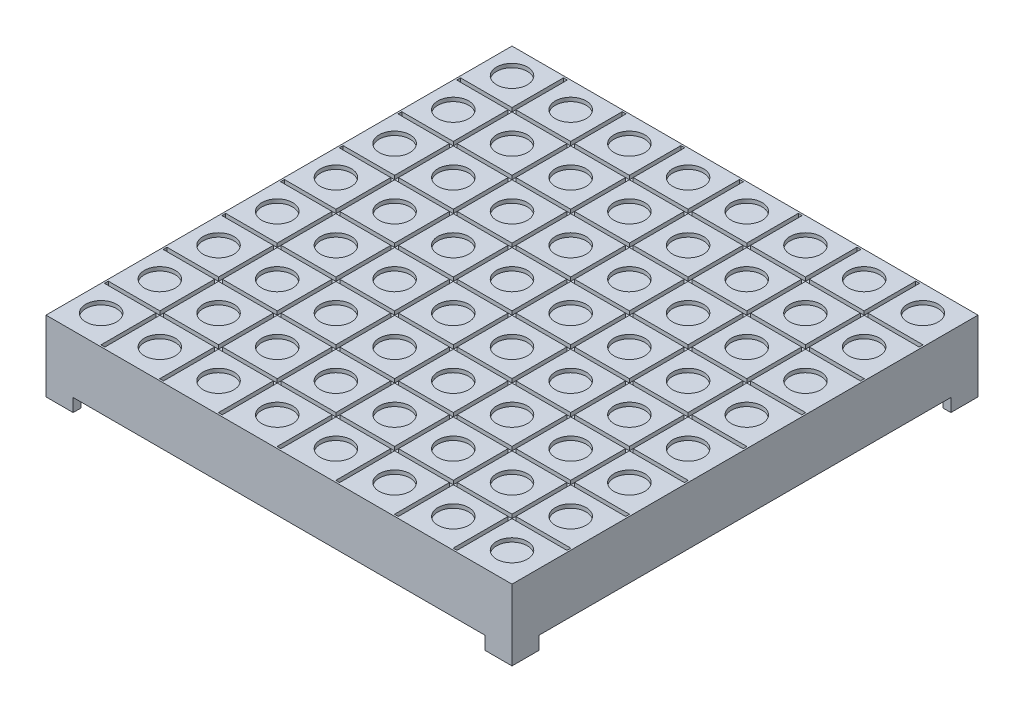
from build123d import *

# Parameters (mm, degrees)
SKETCH_2_W          = 60.5
SKETCH_2_H          = 60.5
EXTRUDE_1_DEPTH     = 7.5
SKETCH_4_W          = 58.5
SKETCH_4_H          = 58.5
CUT_EXTRUDE_2_DEPTH = 1
EXTRUDE_2_DEPTH     = 1.7
SKETCH_3_R          = 2
SKETCH_3_W          = 7.12
SKETCH_3_H          = 7.12
CUT_EXTRUDE_4_DEPTH = 0.5
SKETCH_8_R          = 0.5
EXTRUDE_3_DEPTH     = 3


with BuildPart() as part:
    # Эскиз2 → Бобышка-Вытянуть1 (new body)
    with BuildSketch(Plane(origin=(0, 0, 0), x_dir=(1, 0, 0), z_dir=(0, 1, 0))):
        Rectangle(SKETCH_2_W, SKETCH_2_H)
    extrude(amount=EXTRUDE_1_DEPTH)

    # Эскиз4 → Вырез-Вытянуть2 (cut)
    with BuildSketch(Plane.XZ):
        Rectangle(SKETCH_4_W, SKETCH_4_H)
    extrude(amount=-CUT_EXTRUDE_2_DEPTH, mode=Mode.SUBTRACT)

    # Эскиз5 → Бобышка-Вытянуть2 (add)
    with BuildSketch(Plane.XZ):
        Polygon((26.725, 30.25), (30.25, 30.25), (30.25, 26.725), (29.25, 26.725), (29.25, 29.25), (26.725, 29.25), align=None)
        Polygon((-26.725, -30.25), (-30.25, -30.25), (-30.25, -26.725), (-29.25, -26.725), (-29.25, -29.25), (-26.725, -29.25), align=None)
        Polygon((-30.25, 30.25), (-30.25, 26.725), (-29.25, 26.725), (-29.25, 29.25), (-26.725, 29.25), (-26.725, 30.25), align=None)
        Polygon((30.25, -30.25), (30.25, -26.725), (29.25, -26.725), (29.25, -29.25), (26.725, -29.25), (26.725, -30.25), align=None)
    extrude(amount=EXTRUDE_2_DEPTH)

    # Эскиз3 → Вырез-Вытянуть4 (cut)
    # profile 1 of 65: a face of its own
    with BuildSketch(Plane(origin=(0, 7.5, 0), x_dir=(1, 0, 0), z_dir=(0, 1, 0))):
        with Locations(Location((26.445, -26.445, 0), (0, 0, 270))):
            Circle(SKETCH_3_R)
    # profile 2 of 65: a face of its own
    with BuildSketch(Plane(origin=(0, 7.5, 0), x_dir=(1, 0, 0), z_dir=(0, 1, 0))):
        with Locations(Location((18.825, -26.445, 0), (0, 0, 270))):
            Circle(SKETCH_3_R)
    # profile 3 of 65: a face of its own
    with BuildSketch(Plane(origin=(0, 7.5, 0), x_dir=(1, 0, 0), z_dir=(0, 1, 0))):
        with Locations(Location((11.205, -26.445, 0), (0, 0, 270))):
            Circle(SKETCH_3_R)
    # profile 4 of 65: a face of its own
    with BuildSketch(Plane(origin=(0, 7.5, 0), x_dir=(1, 0, 0), z_dir=(0, 1, 0))):
        with Locations(Location((3.585, -26.445, 0), (0, 0, 270))):
            Circle(SKETCH_3_R)
    # profile 5 of 65: a face of its own
    with BuildSketch(Plane(origin=(0, 7.5, 0), x_dir=(1, 0, 0), z_dir=(0, 1, 0))):
        with Locations(Location((-4.035, -26.445, 0), (0, 0, 270))):
            Circle(SKETCH_3_R)
    # profile 6 of 65: a face of its own
    with BuildSketch(Plane(origin=(0, 7.5, 0), x_dir=(1, 0, 0), z_dir=(0, 1, 0))):
        with Locations(Location((-11.655, -26.445, 0), (0, 0, 270))):
            Circle(SKETCH_3_R)
    # profile 7 of 65: a face of its own
    with BuildSketch(Plane(origin=(0, 7.5, 0), x_dir=(1, 0, 0), z_dir=(0, 1, 0))):
        with Locations(Location((-19.275, -26.445, 0), (0, 0, 270))):
            Circle(SKETCH_3_R)
    # profile 8 of 65: a face of its own
    with BuildSketch(Plane(origin=(0, 7.5, 0), x_dir=(1, 0, 0), z_dir=(0, 1, 0))):
        with Locations(Location((-26.895, -26.445, 0), (0, 0, 270))):
            Circle(SKETCH_3_R)
    # profile 9 of 65: a face of its own
    with BuildSketch(Plane(origin=(0, 7.5, 0), x_dir=(1, 0, 0), z_dir=(0, 1, 0))):
        with Locations(Location((-26.895, -18.825, 0), (0, 0, 270))):
            Circle(SKETCH_3_R)
    # profile 10 of 65: a face of its own
    with BuildSketch(Plane(origin=(0, 7.5, 0), x_dir=(1, 0, 0), z_dir=(0, 1, 0))):
        with Locations(Location((-26.895, -11.205, 0), (0, 0, 270))):
            Circle(SKETCH_3_R)
    # profile 11 of 65: a face of its own
    with BuildSketch(Plane(origin=(0, 7.5, 0), x_dir=(1, 0, 0), z_dir=(0, 1, 0))):
        with Locations(Location((-26.895, -3.585, 0), (0, 0, 270))):
            Circle(SKETCH_3_R)
    # profile 12 of 65: a face of its own
    with BuildSketch(Plane(origin=(0, 7.5, 0), x_dir=(1, 0, 0), z_dir=(0, 1, 0))):
        with Locations(Location((-26.895, 4.035, 0), (0, 0, 270))):
            Circle(SKETCH_3_R)
    # profile 13 of 65: a face of its own
    with BuildSketch(Plane(origin=(0, 7.5, 0), x_dir=(1, 0, 0), z_dir=(0, 1, 0))):
        with Locations(Location((-26.895, 11.655, 0), (0, 0, 270))):
            Circle(SKETCH_3_R)
    # profile 14 of 65: a face of its own
    with BuildSketch(Plane(origin=(0, 7.5, 0), x_dir=(1, 0, 0), z_dir=(0, 1, 0))):
        with Locations(Location((-26.895, 19.275, 0), (0, 0, 270))):
            Circle(SKETCH_3_R)
    # profile 15 of 65: a face of its own
    with BuildSketch(Plane(origin=(0, 7.5, 0), x_dir=(1, 0, 0), z_dir=(0, 1, 0))):
        with Locations(Location((18.825, 26.895, 0), (0, 0, 270))):
            Circle(SKETCH_3_R)
    # profile 16 of 65: a face of its own
    with BuildSketch(Plane(origin=(0, 7.5, 0), x_dir=(1, 0, 0), z_dir=(0, 1, 0))):
        with Locations(Location((11.205, 26.895, 0), (0, 0, 270))):
            Circle(SKETCH_3_R)
    # profile 17 of 65: a face of its own
    with BuildSketch(Plane(origin=(0, 7.5, 0), x_dir=(1, 0, 0), z_dir=(0, 1, 0))):
        with Locations(Location((3.585, 26.895, 0), (0, 0, 270))):
            Circle(SKETCH_3_R)
    # profile 18 of 65: a face of its own
    with BuildSketch(Plane(origin=(0, 7.5, 0), x_dir=(1, 0, 0), z_dir=(0, 1, 0))):
        with Locations(Location((-4.035, 26.895, 0), (0, 0, 270))):
            Circle(SKETCH_3_R)
    # profile 19 of 65: a face of its own
    with BuildSketch(Plane(origin=(0, 7.5, 0), x_dir=(1, 0, 0), z_dir=(0, 1, 0))):
        with Locations(Location((-11.655, 26.895, 0), (0, 0, 270))):
            Circle(SKETCH_3_R)
    # profile 20 of 65: a face of its own
    with BuildSketch(Plane(origin=(0, 7.5, 0), x_dir=(1, 0, 0), z_dir=(0, 1, 0))):
        with Locations(Location((-19.275, 26.895, 0), (0, 0, 270))):
            Circle(SKETCH_3_R)
    # profile 21 of 65: a face of its own
    with BuildSketch(Plane(origin=(0, 7.5, 0), x_dir=(1, 0, 0), z_dir=(0, 1, 0))):
        with Locations(Location((-26.895, 26.895, 0), (0, 0, 270))):
            Circle(SKETCH_3_R)
    # profile 22 of 65: a face of its own
    with BuildSketch(Plane(origin=(0, 7.5, 0), x_dir=(1, 0, 0), z_dir=(0, 1, 0))):
        with Locations(Location((26.445, -18.825, 0), (0, 0, 270))):
            Circle(SKETCH_3_R)
    # profile 23 of 65: a face of its own
    with BuildSketch(Plane(origin=(0, 7.5, 0), x_dir=(1, 0, 0), z_dir=(0, 1, 0))):
        with Locations(Location((26.445, -11.205, 0), (0, 0, 270))):
            Circle(SKETCH_3_R)
    # profile 24 of 65: a face of its own
    with BuildSketch(Plane(origin=(0, 7.5, 0), x_dir=(1, 0, 0), z_dir=(0, 1, 0))):
        with Locations(Location((26.445, -3.585, 0), (0, 0, 270))):
            Circle(SKETCH_3_R)
    # profile 25 of 65: a face of its own
    with BuildSketch(Plane(origin=(0, 7.5, 0), x_dir=(1, 0, 0), z_dir=(0, 1, 0))):
        with Locations(Location((26.445, 4.035, 0), (0, 0, 270))):
            Circle(SKETCH_3_R)
    # profile 26 of 65: a face of its own
    with BuildSketch(Plane(origin=(0, 7.5, 0), x_dir=(1, 0, 0), z_dir=(0, 1, 0))):
        with Locations(Location((26.445, 11.655, 0), (0, 0, 270))):
            Circle(SKETCH_3_R)
    # profile 27 of 65: a face of its own
    with BuildSketch(Plane(origin=(0, 7.5, 0), x_dir=(1, 0, 0), z_dir=(0, 1, 0))):
        with Locations(Location((26.445, 19.275, 0), (0, 0, 270))):
            Circle(SKETCH_3_R)
    # profile 28 of 65: a face of its own
    with BuildSketch(Plane(origin=(0, 7.5, 0), x_dir=(1, 0, 0), z_dir=(0, 1, 0))):
        with Locations(Location((26.445, 26.895, 0), (0, 0, 270))):
            Circle(SKETCH_3_R)
    # profile 29 of 65: a face of its own
    with BuildSketch(Plane(origin=(0, 7.5, 0), x_dir=(1, 0, 0), z_dir=(0, 1, 0))):
        Polygon((22.885, -30.025), (22.885, -22.885), (30.025, -22.885), (30.025, -22.385), (22.885, -22.385), (22.885, -15.265), (30.025, -15.265), (30.025, -14.765), (22.885, -14.765), (22.885, -7.645), (30.025, -7.645), (30.025, -7.145), (22.885, -7.145), (22.885, -0.025), (30.025, -0.025), (30.025, 0.475), (22.885, 0.475), (22.885, 7.595), (30.025, 7.595), (30.025, 8.095), (22.885, 8.095), (22.885, 15.215), (30.025, 15.215), (30.025, 15.715), (22.885, 15.715), (22.885, 22.835), (30.025, 22.835), (30.025, 23.335), (22.885, 23.335), (22.885, 30.025), (22.385, 30.025), (22.385, 23.335), (15.265, 23.335), (15.265, 30.025), (14.765, 30.025), (14.765, 23.335), (7.645, 23.335), (7.645, 30.025), (7.145, 30.025), (7.145, 23.335), (0.025, 23.335), (0.025, 30.025), (-0.475, 30.025), (-0.475, 23.335), (-7.595, 23.335), (-7.595, 30.025), (-8.095, 30.025), (-8.095, 23.335), (-15.215, 23.335), (-15.215, 30.025), (-15.715, 30.025), (-15.715, 23.335), (-22.835, 23.335), (-22.835, 30.025), (-23.335, 30.025), (-23.335, 23.335), (-30.025, 23.335), (-30.025, 22.835), (-23.335, 22.835), (-23.335, 15.715), (-30.025, 15.715), (-30.025, 15.215), (-23.335, 15.215), (-23.335, 8.095), (-30.025, 8.095), (-30.025, 7.595), (-23.335, 7.595), (-23.335, 0.475), (-30.025, 0.475), (-30.025, -0.025), (-23.335, -0.025), (-23.335, -7.145), (-30.025, -7.145), (-30.025, -7.645), (-23.335, -7.645), (-23.335, -14.765), (-30.025, -14.765), (-30.025, -15.265), (-23.335, -15.265), (-23.335, -22.385), (-30.025, -22.385), (-30.025, -22.885), (-23.335, -22.885), (-23.335, -30.025), (-22.835, -30.025), (-22.835, -22.885), (-15.715, -22.885), (-15.715, -30.025), (-15.215, -30.025), (-15.215, -22.885), (-8.095, -22.885), (-8.095, -30.025), (-7.595, -30.025), (-7.595, -22.885), (-0.475, -22.885), (-0.475, -30.025), (0.025, -30.025), (0.025, -22.885), (7.145, -22.885), (7.145, -30.025), (7.645, -30.025), (7.645, -22.885), (14.765, -22.885), (14.765, -30.025), (15.265, -30.025), (15.265, -22.885), (22.385, -22.885), (22.385, -30.025), align=None)
        with Locations((-19.275, -11.205)):
            Rectangle(SKETCH_3_W, SKETCH_3_H, mode=Mode.SUBTRACT)
        with Locations((-11.655, -11.205)):
            Rectangle(SKETCH_3_W, SKETCH_3_H, mode=Mode.SUBTRACT)
        with Locations((18.825, -18.825)):
            Rectangle(SKETCH_3_W, SKETCH_3_H, mode=Mode.SUBTRACT)
        with Locations((11.205, -18.825)):
            Rectangle(SKETCH_3_W, SKETCH_3_H, mode=Mode.SUBTRACT)
        with Locations((3.585, -18.825)):
            Rectangle(SKETCH_3_W, SKETCH_3_H, mode=Mode.SUBTRACT)
        with Locations((-4.035, -18.825)):
            Rectangle(SKETCH_3_W, SKETCH_3_H, mode=Mode.SUBTRACT)
        with Locations((-11.655, -18.825)):
            Rectangle(SKETCH_3_W, SKETCH_3_H, mode=Mode.SUBTRACT)
        with Locations((-19.275, -18.825)):
            Rectangle(SKETCH_3_W, SKETCH_3_H, mode=Mode.SUBTRACT)
        with Locations((-4.035, -11.205)):
            Rectangle(SKETCH_3_W, SKETCH_3_H, mode=Mode.SUBTRACT)
        with Locations((3.585, -11.205)):
            Rectangle(SKETCH_3_W, SKETCH_3_H, mode=Mode.SUBTRACT)
        with Locations((11.205, -11.205)):
            Rectangle(SKETCH_3_W, SKETCH_3_H, mode=Mode.SUBTRACT)
        with Locations((18.825, -11.205)):
            Rectangle(SKETCH_3_W, SKETCH_3_H, mode=Mode.SUBTRACT)
        with Locations((18.825, -3.585)):
            Rectangle(SKETCH_3_W, SKETCH_3_H, mode=Mode.SUBTRACT)
        with Locations((11.205, -3.585)):
            Rectangle(SKETCH_3_W, SKETCH_3_H, mode=Mode.SUBTRACT)
        with Locations((3.585, -3.585)):
            Rectangle(SKETCH_3_W, SKETCH_3_H, mode=Mode.SUBTRACT)
        with Locations((-4.035, -3.585)):
            Rectangle(SKETCH_3_W, SKETCH_3_H, mode=Mode.SUBTRACT)
        with Locations((-11.655, -3.585)):
            Rectangle(SKETCH_3_W, SKETCH_3_H, mode=Mode.SUBTRACT)
        with Locations((-19.275, -3.585)):
            Rectangle(SKETCH_3_W, SKETCH_3_H, mode=Mode.SUBTRACT)
        with Locations((-19.275, 4.035)):
            Rectangle(SKETCH_3_W, SKETCH_3_H, mode=Mode.SUBTRACT)
        with Locations((-11.655, 4.035)):
            Rectangle(SKETCH_3_W, SKETCH_3_H, mode=Mode.SUBTRACT)
        with Locations((-4.035, 4.035)):
            Rectangle(SKETCH_3_W, SKETCH_3_H, mode=Mode.SUBTRACT)
        with Locations((3.585, 4.035)):
            Rectangle(SKETCH_3_W, SKETCH_3_H, mode=Mode.SUBTRACT)
        with Locations((11.205, 4.035)):
            Rectangle(SKETCH_3_W, SKETCH_3_H, mode=Mode.SUBTRACT)
        with Locations((18.825, 4.035)):
            Rectangle(SKETCH_3_W, SKETCH_3_H, mode=Mode.SUBTRACT)
        with Locations((18.825, 11.655)):
            Rectangle(SKETCH_3_W, SKETCH_3_H, mode=Mode.SUBTRACT)
        with Locations((11.205, 11.655)):
            Rectangle(SKETCH_3_W, SKETCH_3_H, mode=Mode.SUBTRACT)
        with Locations((3.585, 11.655)):
            Rectangle(SKETCH_3_W, SKETCH_3_H, mode=Mode.SUBTRACT)
        with Locations((-4.035, 11.655)):
            Rectangle(SKETCH_3_W, SKETCH_3_H, mode=Mode.SUBTRACT)
        with Locations((-11.655, 11.655)):
            Rectangle(SKETCH_3_W, SKETCH_3_H, mode=Mode.SUBTRACT)
        with Locations((-19.275, 11.655)):
            Rectangle(SKETCH_3_W, SKETCH_3_H, mode=Mode.SUBTRACT)
        with Locations((18.825, 19.275)):
            Rectangle(SKETCH_3_W, SKETCH_3_H, mode=Mode.SUBTRACT)
        with Locations((11.205, 19.275)):
            Rectangle(SKETCH_3_W, SKETCH_3_H, mode=Mode.SUBTRACT)
        with Locations((3.585, 19.275)):
            Rectangle(SKETCH_3_W, SKETCH_3_H, mode=Mode.SUBTRACT)
        with Locations((-4.035, 19.275)):
            Rectangle(SKETCH_3_W, SKETCH_3_H, mode=Mode.SUBTRACT)
        with Locations((-11.655, 19.275)):
            Rectangle(SKETCH_3_W, SKETCH_3_H, mode=Mode.SUBTRACT)
        with Locations((-19.275, 19.275)):
            Rectangle(SKETCH_3_W, SKETCH_3_H, mode=Mode.SUBTRACT)
    # profile 30 of 65: a face of its own
    with BuildSketch(Plane(origin=(0, 7.5, 0), x_dir=(1, 0, 0), z_dir=(0, 1, 0))):
        with Locations(Location((-19.275, 19.275, 0), (0, 0, 270))):
            Circle(SKETCH_3_R)
    # profile 31 of 65: a face of its own
    with BuildSketch(Plane(origin=(0, 7.5, 0), x_dir=(1, 0, 0), z_dir=(0, 1, 0))):
        with Locations(Location((-11.655, 19.275, 0), (0, 0, 270))):
            Circle(SKETCH_3_R)
    # profile 32 of 65: a face of its own
    with BuildSketch(Plane(origin=(0, 7.5, 0), x_dir=(1, 0, 0), z_dir=(0, 1, 0))):
        with Locations(Location((-4.035, 19.275, 0), (0, 0, 270))):
            Circle(SKETCH_3_R)
    # profile 33 of 65: a face of its own
    with BuildSketch(Plane(origin=(0, 7.5, 0), x_dir=(1, 0, 0), z_dir=(0, 1, 0))):
        with Locations(Location((3.585, 19.275, 0), (0, 0, 270))):
            Circle(SKETCH_3_R)
    # profile 34 of 65: a face of its own
    with BuildSketch(Plane(origin=(0, 7.5, 0), x_dir=(1, 0, 0), z_dir=(0, 1, 0))):
        with Locations(Location((11.205, 19.275, 0), (0, 0, 270))):
            Circle(SKETCH_3_R)
    # profile 35 of 65: a face of its own
    with BuildSketch(Plane(origin=(0, 7.5, 0), x_dir=(1, 0, 0), z_dir=(0, 1, 0))):
        with Locations(Location((18.825, 19.275, 0), (0, 0, 270))):
            Circle(SKETCH_3_R)
    # profile 36 of 65: a face of its own
    with BuildSketch(Plane(origin=(0, 7.5, 0), x_dir=(1, 0, 0), z_dir=(0, 1, 0))):
        with Locations(Location((-19.275, 11.655, 0), (0, 0, 270))):
            Circle(SKETCH_3_R)
    # profile 37 of 65: a face of its own
    with BuildSketch(Plane(origin=(0, 7.5, 0), x_dir=(1, 0, 0), z_dir=(0, 1, 0))):
        with Locations(Location((-11.655, 11.655, 0), (0, 0, 270))):
            Circle(SKETCH_3_R)
    # profile 38 of 65: a face of its own
    with BuildSketch(Plane(origin=(0, 7.5, 0), x_dir=(1, 0, 0), z_dir=(0, 1, 0))):
        with Locations(Location((-4.035, 11.655, 0), (0, 0, 270))):
            Circle(SKETCH_3_R)
    # profile 39 of 65: a face of its own
    with BuildSketch(Plane(origin=(0, 7.5, 0), x_dir=(1, 0, 0), z_dir=(0, 1, 0))):
        with Locations(Location((3.585, 11.655, 0), (0, 0, 270))):
            Circle(SKETCH_3_R)
    # profile 40 of 65: a face of its own
    with BuildSketch(Plane(origin=(0, 7.5, 0), x_dir=(1, 0, 0), z_dir=(0, 1, 0))):
        with Locations(Location((11.205, 11.655, 0), (0, 0, 270))):
            Circle(SKETCH_3_R)
    # profile 41 of 65: a face of its own
    with BuildSketch(Plane(origin=(0, 7.5, 0), x_dir=(1, 0, 0), z_dir=(0, 1, 0))):
        with Locations(Location((18.825, 11.655, 0), (0, 0, 270))):
            Circle(SKETCH_3_R)
    # profile 42 of 65: a face of its own
    with BuildSketch(Plane(origin=(0, 7.5, 0), x_dir=(1, 0, 0), z_dir=(0, 1, 0))):
        with Locations(Location((-19.275, 4.035, 0), (0, 0, 270))):
            Circle(SKETCH_3_R)
    # profile 43 of 65: a face of its own
    with BuildSketch(Plane(origin=(0, 7.5, 0), x_dir=(1, 0, 0), z_dir=(0, 1, 0))):
        with Locations(Location((-11.655, 4.035, 0), (0, 0, 270))):
            Circle(SKETCH_3_R)
    # profile 44 of 65: a face of its own
    with BuildSketch(Plane(origin=(0, 7.5, 0), x_dir=(1, 0, 0), z_dir=(0, 1, 0))):
        with Locations(Location((-4.035, 4.035, 0), (0, 0, 270))):
            Circle(SKETCH_3_R)
    # profile 45 of 65: a face of its own
    with BuildSketch(Plane(origin=(0, 7.5, 0), x_dir=(1, 0, 0), z_dir=(0, 1, 0))):
        with Locations(Location((3.585, 4.035, 0), (0, 0, 270))):
            Circle(SKETCH_3_R)
    # profile 46 of 65: a face of its own
    with BuildSketch(Plane(origin=(0, 7.5, 0), x_dir=(1, 0, 0), z_dir=(0, 1, 0))):
        with Locations(Location((11.205, 4.035, 0), (0, 0, 270))):
            Circle(SKETCH_3_R)
    # profile 47 of 65: a face of its own
    with BuildSketch(Plane(origin=(0, 7.5, 0), x_dir=(1, 0, 0), z_dir=(0, 1, 0))):
        with Locations(Location((18.825, 4.035, 0), (0, 0, 270))):
            Circle(SKETCH_3_R)
    # profile 48 of 65: a face of its own
    with BuildSketch(Plane(origin=(0, 7.5, 0), x_dir=(1, 0, 0), z_dir=(0, 1, 0))):
        with Locations(Location((-19.275, -3.585, 0), (0, 0, 270))):
            Circle(SKETCH_3_R)
    # profile 49 of 65: a face of its own
    with BuildSketch(Plane(origin=(0, 7.5, 0), x_dir=(1, 0, 0), z_dir=(0, 1, 0))):
        with Locations(Location((-11.655, -3.585, 0), (0, 0, 270))):
            Circle(SKETCH_3_R)
    # profile 50 of 65: a face of its own
    with BuildSketch(Plane(origin=(0, 7.5, 0), x_dir=(1, 0, 0), z_dir=(0, 1, 0))):
        with Locations(Location((-4.035, -3.585, 0), (0, 0, 270))):
            Circle(SKETCH_3_R)
    # profile 51 of 65: a face of its own
    with BuildSketch(Plane(origin=(0, 7.5, 0), x_dir=(1, 0, 0), z_dir=(0, 1, 0))):
        with Locations(Location((3.585, -3.585, 0), (0, 0, 270))):
            Circle(SKETCH_3_R)
    # profile 52 of 65: a face of its own
    with BuildSketch(Plane(origin=(0, 7.5, 0), x_dir=(1, 0, 0), z_dir=(0, 1, 0))):
        with Locations(Location((11.205, -3.585, 0), (0, 0, 270))):
            Circle(SKETCH_3_R)
    # profile 53 of 65: a face of its own
    with BuildSketch(Plane(origin=(0, 7.5, 0), x_dir=(1, 0, 0), z_dir=(0, 1, 0))):
        with Locations(Location((18.825, -3.585, 0), (0, 0, 270))):
            Circle(SKETCH_3_R)
    # profile 54 of 65: a face of its own
    with BuildSketch(Plane(origin=(0, 7.5, 0), x_dir=(1, 0, 0), z_dir=(0, 1, 0))):
        with Locations(Location((-19.275, -11.205, 0), (0, 0, 270))):
            Circle(SKETCH_3_R)
    # profile 55 of 65: a face of its own
    with BuildSketch(Plane(origin=(0, 7.5, 0), x_dir=(1, 0, 0), z_dir=(0, 1, 0))):
        with Locations(Location((-11.655, -11.205, 0), (0, 0, 270))):
            Circle(SKETCH_3_R)
    # profile 56 of 65: a face of its own
    with BuildSketch(Plane(origin=(0, 7.5, 0), x_dir=(1, 0, 0), z_dir=(0, 1, 0))):
        with Locations(Location((-4.035, -11.205, 0), (0, 0, 270))):
            Circle(SKETCH_3_R)
    # profile 57 of 65: a face of its own
    with BuildSketch(Plane(origin=(0, 7.5, 0), x_dir=(1, 0, 0), z_dir=(0, 1, 0))):
        with Locations(Location((3.585, -11.205, 0), (0, 0, 270))):
            Circle(SKETCH_3_R)
    # profile 58 of 65: a face of its own
    with BuildSketch(Plane(origin=(0, 7.5, 0), x_dir=(1, 0, 0), z_dir=(0, 1, 0))):
        with Locations(Location((11.205, -11.205, 0), (0, 0, 270))):
            Circle(SKETCH_3_R)
    # profile 59 of 65: a face of its own
    with BuildSketch(Plane(origin=(0, 7.5, 0), x_dir=(1, 0, 0), z_dir=(0, 1, 0))):
        with Locations(Location((18.825, -11.205, 0), (0, 0, 270))):
            Circle(SKETCH_3_R)
    # profile 60 of 65: a face of its own
    with BuildSketch(Plane(origin=(0, 7.5, 0), x_dir=(1, 0, 0), z_dir=(0, 1, 0))):
        with Locations(Location((-19.275, -18.825, 0), (0, 0, 270))):
            Circle(SKETCH_3_R)
    # profile 61 of 65: a face of its own
    with BuildSketch(Plane(origin=(0, 7.5, 0), x_dir=(1, 0, 0), z_dir=(0, 1, 0))):
        with Locations(Location((-11.655, -18.825, 0), (0, 0, 270))):
            Circle(SKETCH_3_R)
    # profile 62 of 65: a face of its own
    with BuildSketch(Plane(origin=(0, 7.5, 0), x_dir=(1, 0, 0), z_dir=(0, 1, 0))):
        with Locations(Location((-4.035, -18.825, 0), (0, 0, 270))):
            Circle(SKETCH_3_R)
    # profile 63 of 65: a face of its own
    with BuildSketch(Plane(origin=(0, 7.5, 0), x_dir=(1, 0, 0), z_dir=(0, 1, 0))):
        with Locations(Location((3.585, -18.825, 0), (0, 0, 270))):
            Circle(SKETCH_3_R)
    # profile 64 of 65: a face of its own
    with BuildSketch(Plane(origin=(0, 7.5, 0), x_dir=(1, 0, 0), z_dir=(0, 1, 0))):
        with Locations(Location((11.205, -18.825, 0), (0, 0, 270))):
            Circle(SKETCH_3_R)
    # profile 65 of 65: a face of its own
    with BuildSketch(Plane(origin=(0, 7.5, 0), x_dir=(1, 0, 0), z_dir=(0, 1, 0))):
        with Locations(Location((18.825, -18.825, 0), (0, 0, 270))):
            Circle(SKETCH_3_R)
    extrude(amount=-CUT_EXTRUDE_4_DEPTH, mode=Mode.SUBTRACT)

    # Эскиз8 → Бобышка-Вытянуть3 (add)
    with BuildSketch(Plane.XZ.offset(-1)):
        with Locations(Location((19.05, -22.86, 0), (0, 0, 90))):
            Circle(SKETCH_8_R)
        with Locations(Location((16.51, -22.86, 0), (0, 0, 90))):
            Circle(SKETCH_8_R)
        with Locations(Location((13.97, -22.86, 0), (0, 0, 90))):
            Circle(SKETCH_8_R)
        with Locations(Location((11.43, -22.86, 0), (0, 0, 90))):
            Circle(SKETCH_8_R)
        with Locations(Location((8.89, -22.86, 0), (0, 0, 90))):
            Circle(SKETCH_8_R)
        with Locations(Location((6.35, -22.86, 0), (0, 0, 90))):
            Circle(SKETCH_8_R)
        with Locations(Location((3.81, -22.86, 0), (0, 0, 90))):
            Circle(SKETCH_8_R)
        with Locations(Location((1.27, -22.86, 0), (0, 0, 90))):
            Circle(SKETCH_8_R)
        with Locations(Location((-1.27, -22.86, 0), (0, 0, 90))):
            Circle(SKETCH_8_R)
        with Locations(Location((-3.81, -22.86, 0), (0, 0, 90))):
            Circle(SKETCH_8_R)
        with Locations(Location((-6.35, -22.86, 0), (0, 0, 90))):
            Circle(SKETCH_8_R)
        with Locations(Location((-8.89, -22.86, 0), (0, 0, 90))):
            Circle(SKETCH_8_R)
        with Locations(Location((-11.43, -22.86, 0), (0, 0, 90))):
            Circle(SKETCH_8_R)
        with Locations(Location((-13.97, -22.86, 0), (0, 0, 90))):
            Circle(SKETCH_8_R)
        with Locations(Location((-16.51, -22.86, 0), (0, 0, 90))):
            Circle(SKETCH_8_R)
        with Locations(Location((-19.05, 22.86, 0), (0, 0, 90))):
            Circle(SKETCH_8_R)
        with Locations(Location((-16.51, 22.86, 0), (0, 0, 90))):
            Circle(SKETCH_8_R)
        with Locations(Location((-13.97, 22.86, 0), (0, 0, 90))):
            Circle(SKETCH_8_R)
        with Locations(Location((-11.43, 22.86, 0), (0, 0, 90))):
            Circle(SKETCH_8_R)
        with Locations(Location((-8.89, 22.86, 0), (0, 0, 90))):
            Circle(SKETCH_8_R)
        with Locations(Location((-6.35, 22.86, 0), (0, 0, 90))):
            Circle(SKETCH_8_R)
        with Locations(Location((-3.81, 22.86, 0), (0, 0, 90))):
            Circle(SKETCH_8_R)
        with Locations(Location((-1.27, 22.86, 0), (0, 0, 90))):
            Circle(SKETCH_8_R)
        with Locations(Location((1.27, 22.86, 0), (0, 0, 90))):
            Circle(SKETCH_8_R)
        with Locations(Location((3.81, 22.86, 0), (0, 0, 90))):
            Circle(SKETCH_8_R)
        with Locations(Location((6.35, 22.86, 0), (0, 0, 90))):
            Circle(SKETCH_8_R)
        with Locations(Location((8.89, 22.86, 0), (0, 0, 90))):
            Circle(SKETCH_8_R)
        with Locations(Location((11.43, 22.86, 0), (0, 0, 90))):
            Circle(SKETCH_8_R)
        with Locations(Location((13.97, 22.86, 0), (0, 0, 90))):
            Circle(SKETCH_8_R)
        with Locations(Location((16.51, 22.86, 0), (0, 0, 90))):
            Circle(SKETCH_8_R)
        with Locations(Location((-19.05, -22.86, 0), (0, 0, 90))):
            Circle(SKETCH_8_R)
        with Locations(Location((19.05, 22.86, 0), (0, 0, 90))):
            Circle(SKETCH_8_R)
    extrude(amount=EXTRUDE_3_DEPTH)


solid = part.part
